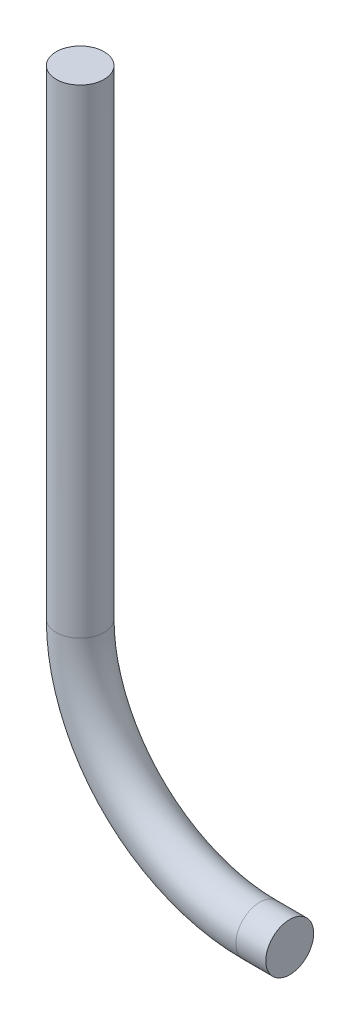
from build123d import *

# Parameters (mm, degrees)
SKETCH2_R = 4


with BuildPart() as part:
    # Sweep1: sweep along a path in Sketch1
    with BuildLine(Plane.XY) as sweep1_path:
        Line((0, 0), (-5, 0))
        ThreePointArc((-5, 0), (-26.213203436, 8.786796564), (-35, 30))
        Line((-35, 30), (-35, 110))
    # Sketch2 → Sweep1 (sweep)
    with BuildSketch(Plane(origin=(0, 0, 0), x_dir=(0, 0, -1), z_dir=(1, 0, 0))):
        Circle(SKETCH2_R)
    sweep(path=sweep1_path.line)


solid = part.part
